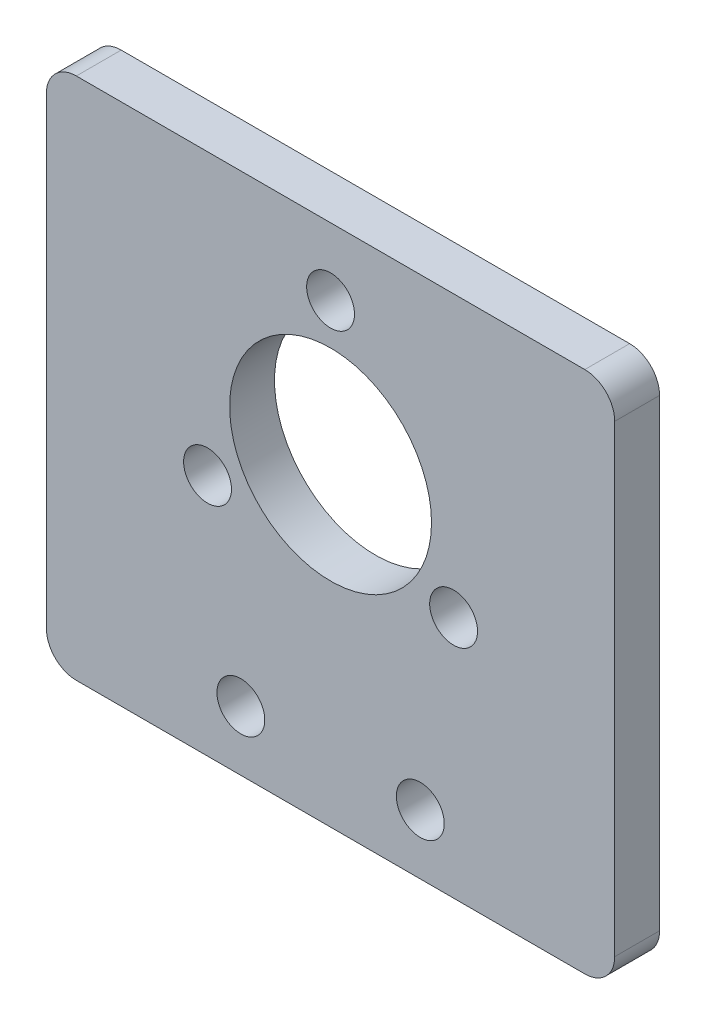
from build123d import *

# Parameters (mm, degrees)
SKETCH_1_R          = 6.75
SKETCH_1_R_2        = 1.6
EXTRUDE_1_DEPTH     = 3
SKETCH_2_R          = 1.6
CUT_EXTRUDE_1_DEPTH = 10
SKETCH_3_W          = 59.008256567
SKETCH_3_H          = 13.932505023
CUT_EXTRUDE_2_DEPTH = 57.71860365
FILLET_1_R          = 2


with BuildPart() as part:
    # 草图1 → 凸台-拉伸1 (new body)
    with BuildSketch(Plane.XY):
        with BuildLine():
            Line((2, 0), (36, 0))
            ThreePointArc((36, 0), (37.414213562, -0.585786438), (38, -2))
            Line((38, -2), (38, -40))
            ThreePointArc((38, -40), (37.414213562, -41.414213562), (36, -42))
            Line((36, -42), (2, -42))
            ThreePointArc((2, -42), (0.585786438, -41.414213562), (0, -40))
            Line((0, -40), (0, -2))
            ThreePointArc((0, -2), (0.585786438, -0.585786438), (2, 0))
        make_face()
        with Locations((19, -21)):
            Circle(SKETCH_1_R, mode=Mode.SUBTRACT)
        with Locations((19, -11.5)):
            Circle(SKETCH_1_R_2, mode=Mode.SUBTRACT)
        with Locations((27.227241336, -25.75)):
            Circle(SKETCH_1_R_2, mode=Mode.SUBTRACT)
        with Locations((10.772758664, -25.75)):
            Circle(SKETCH_1_R_2, mode=Mode.SUBTRACT)
    extrude(amount=EXTRUDE_1_DEPTH)

    # 草图2 → 切除-拉伸1 (cut)
    with BuildSketch(Plane(origin=(0, 0, 0), x_dir=(-1, 0, 0), z_dir=(0, 0, -1))):
        with Locations((-13, -38)):
            Circle(SKETCH_2_R)
        with Locations((-25, -38)):
            Circle(SKETCH_2_R)
    extrude(amount=-CUT_EXTRUDE_1_DEPTH, mode=Mode.SUBTRACT)

    # 草图3 → 切除-拉伸2 (cut, through all)
    with BuildSketch(Plane.XY.offset(3)):
        with Locations((20.753628174, -0.033747488)):
            Rectangle(SKETCH_3_W, SKETCH_3_H)
    extrude(amount=-CUT_EXTRUDE_2_DEPTH, mode=Mode.SUBTRACT)

    # 圆角1
    fillet_1_edges = [part.edges().sort_by_distance(p)[0] for p in [
        (38, -7, 1.5),
        (0, -7, 1.5),
    ]]
    fillet(fillet_1_edges, radius=FILLET_1_R)


solid = part.part
